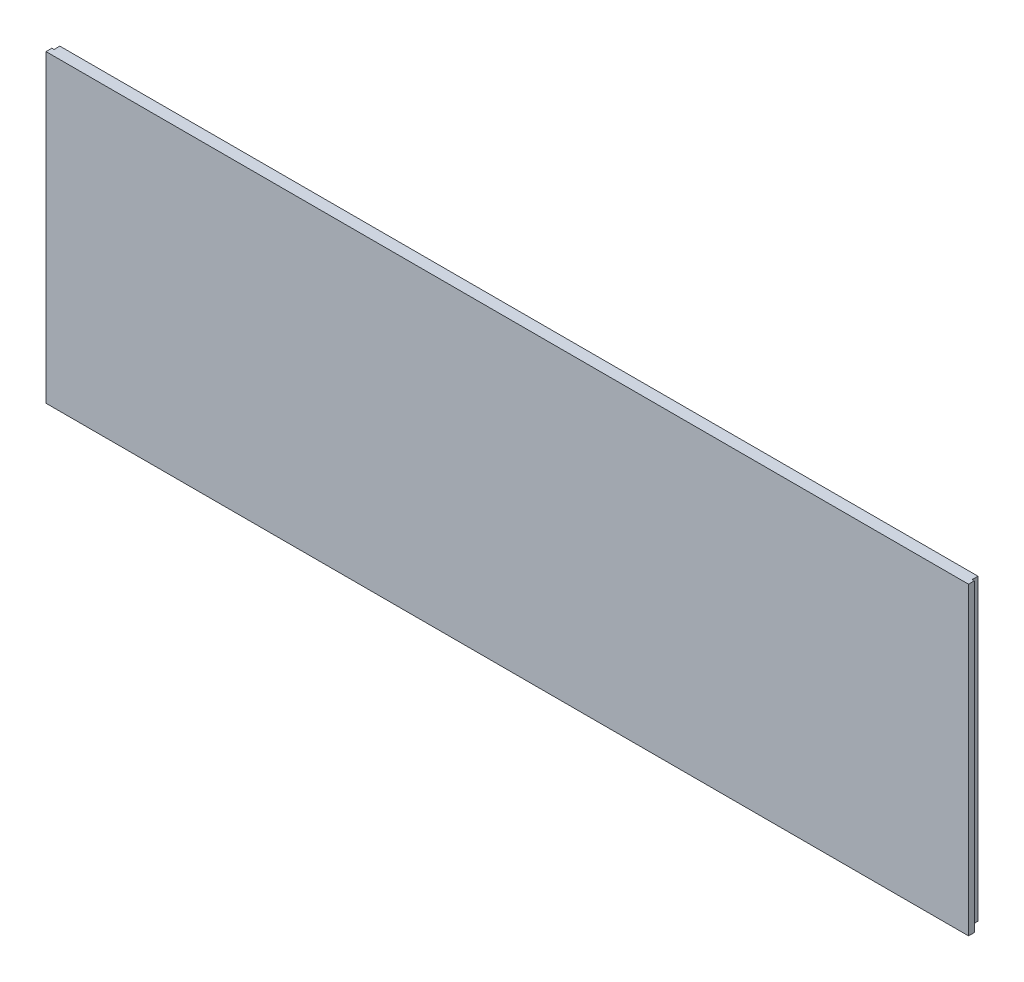
from build123d import *

# Parameters (mm, degrees)
SKETCH1_W                                    = 316.5
SKETCH1_H                                    = 104.5
DIGITIZER_DEPTH                              = 2
SKETCH2_W                                    = 315
SKETCH2_H                                    = 102.5
DISPLAY_WITHOUT_MARGIN_SINCE_USING_2MM_DEPTH = 2
SKETCH3_W                                    = 70
SKETCH3_H                                    = 4
DIGITIZER_CABLE_DEPTH                        = 2


with BuildPart() as part:
    # Sketch1 → DIGITIZER (new body)
    with BuildSketch(Plane.XY):
        Rectangle(SKETCH1_W, SKETCH1_H)
    extrude(amount=DIGITIZER_DEPTH)

    # Sketch2 → DISPLAY WITHOUT MARGIN SINCE USING .2MM ADHESIVE NOW (add)
    with BuildSketch(Plane(origin=(0, 0, 0), x_dir=(-1, 0, 0), z_dir=(0, 0, -1))):
        with Locations((0, 1)):
            Rectangle(SKETCH2_W, SKETCH2_H)
    extrude(amount=DISPLAY_WITHOUT_MARGIN_SINCE_USING_2MM_DEPTH)

    # Sketch3 → DIGITIZER CABLE (add)
    with BuildSketch(Plane(origin=(0, 0, 0), x_dir=(-1, 0, 0), z_dir=(0, 0, -1))):
        with Locations((0, -52.25)):
            Rectangle(SKETCH3_W, SKETCH3_H)
    extrude(amount=DIGITIZER_CABLE_DEPTH)


solid = part.part
